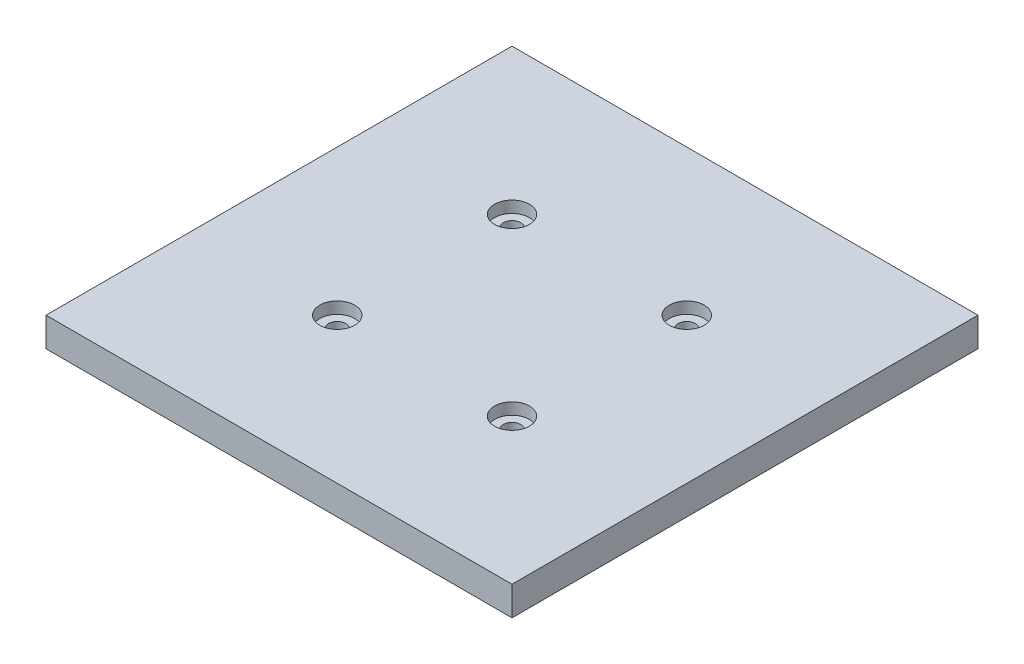
from build123d import *

# Parameters (mm, degrees)
ESQUISSE1_W             = 80
ESQUISSE1_H             = 80
ESQUISSE1_R             = 1.5
EXTRUSION1_DEPTH        = 5
ESQUISSE2_R             = 3
ENL_V_MAT_EXTRU_1_DEPTH = 2


with BuildPart() as part:
    # Esquisse1 → Extrusion1 (new body)
    with BuildSketch(Plane(origin=(0, 0, 0), x_dir=(1, 0, 0), z_dir=(0, 1, 0))):
        Rectangle(ESQUISSE1_W, ESQUISSE1_H)
        with Locations(Location((-15, 15, 0), (0, 0, 270))):
            Circle(ESQUISSE1_R, mode=Mode.SUBTRACT)
        with Locations(Location((15, 15, 0), (0, 0, 90))):
            Circle(ESQUISSE1_R, mode=Mode.SUBTRACT)
        with Locations(Location((-15, -15, 0), (0, 0, 90))):
            Circle(ESQUISSE1_R, mode=Mode.SUBTRACT)
        with Locations(Location((15, -15, 0), (0, 0, 270))):
            Circle(ESQUISSE1_R, mode=Mode.SUBTRACT)
    extrude(amount=EXTRUSION1_DEPTH)

    # Esquisse2 → Enlèv. mat.-Extru.1 (cut)
    with BuildSketch(Plane(origin=(0, 5, 0), x_dir=(1, 0, 0), z_dir=(0, 1, 0))):
        with Locations(Location((-15, 15, 0), (0, 0, 270))):
            Circle(ESQUISSE2_R)
        with Locations(Location((15, 15, 0), (0, 0, 90))):
            Circle(ESQUISSE2_R)
        with Locations(Location((15, -15, 0), (0, 0, 270))):
            Circle(ESQUISSE2_R)
        with Locations(Location((-15, -15, 0), (0, 0, 90))):
            Circle(ESQUISSE2_R)
    extrude(amount=-ENL_V_MAT_EXTRU_1_DEPTH, mode=Mode.SUBTRACT)


solid = part.part
